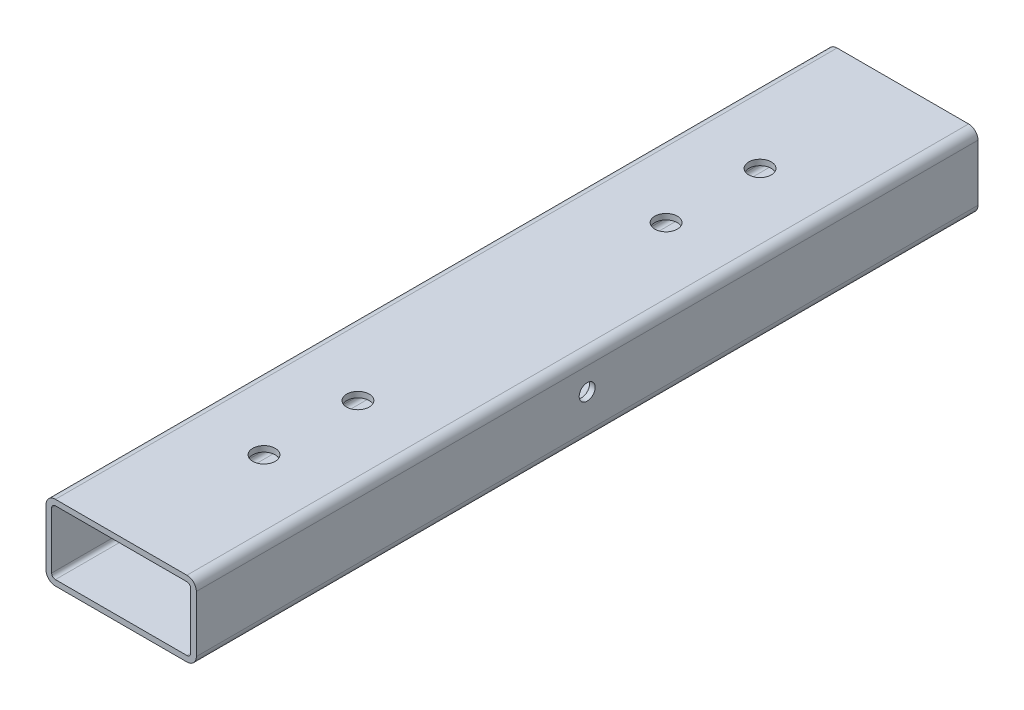
from build123d import *

# Parameters (mm, degrees)
EXTRUDE_1_DEPTH        = 208
HOLE_WIZARD_M101_D     = 8.5
HOLE_WIZARD_M101_DEPTH = 27.5
HOLE_WIZARD_M101_TIP   = 2.553657631
SKETCH_6_R             = 6
CUT_EXTRUDE_2_DEPTH    = 216.555097365
PATTERN_LINEAR_1_COUNT = 2
PATTERN_LINEAR_1_PITCH = 214


with BuildPart() as part:
    # Эскиз1 → Бобышка-Вытянуть1 (new, symmetric)
    with BuildSketch(Plane.XY):
        with BuildLine():
            Line((-35, -20), (35, -20))
            ThreePointArc((35, -20), (38.535533906, -18.535533906), (40, -15))
            Line((40, -15), (40, 15))
            ThreePointArc((40, 15), (38.535533906, 18.535533906), (35, 20))
            Line((35, 20), (-35, 20))
            ThreePointArc((-35, 20), (-38.535533906, 18.535533906), (-40, 15))
            Line((-40, 15), (-40, -15))
            ThreePointArc((-40, -15), (-38.535533906, -18.535533906), (-35, -20))
        make_face()
        with BuildLine():
            Line((-35, -17), (35, -17))
            ThreePointArc((35, -17), (36.414213562, -16.414213562), (37, -15))
            Line((37, -15), (37, 15))
            ThreePointArc((37, 15), (36.414213562, 16.414213562), (35, 17))
            Line((35, 17), (-35, 17))
            ThreePointArc((-35, 17), (-36.414213562, 16.414213562), (-37, 15))
            Line((-37, 15), (-37, -15))
            ThreePointArc((-37, -15), (-36.414213562, -16.414213562), (-35, -17))
        make_face(mode=Mode.SUBTRACT)
    extrude(amount=EXTRUDE_1_DEPTH, both=True)

    # Отверстие обработанное метчиком M101
    with Locations(Plane(origin=(40, 0, 0), x_dir=(0, 0, -1), z_dir=(1, 0, 0))):
        with Locations((400, 3), (0, 3), (-400, 3)):
            Hole(HOLE_WIZARD_M101_D / 2, depth=HOLE_WIZARD_M101_DEPTH)
            with Locations((0, 0, -(HOLE_WIZARD_M101_DEPTH + HOLE_WIZARD_M101_TIP / 2))):  # 118° drill point
                Cone(0, HOLE_WIZARD_M101_D / 2, HOLE_WIZARD_M101_TIP, mode=Mode.SUBTRACT)

    # Эскиз6 → Вырез-Вытянуть2 (cut, symmetric)
    with BuildSketch(Plane.XZ.offset(20)):
        with Locations(Location((0, 132, 0), (0, 0, 270))):
            Circle(SKETCH_6_R)
        with Locations(Location((0, 82, 0), (0, 0, 270))):
            Circle(SKETCH_6_R)
    cut_extrude_2 = extrude(amount=CUT_EXTRUDE_2_DEPTH, both=True, mode=Mode.SUBTRACT)

    # Линейный массив1: Вырез-Вытянуть2 ×2
    with Locations(*[(0, 0, -i * PATTERN_LINEAR_1_PITCH) for i in range(1, PATTERN_LINEAR_1_COUNT)]):
        add(cut_extrude_2, mode=Mode.SUBTRACT)


solid = part.part
